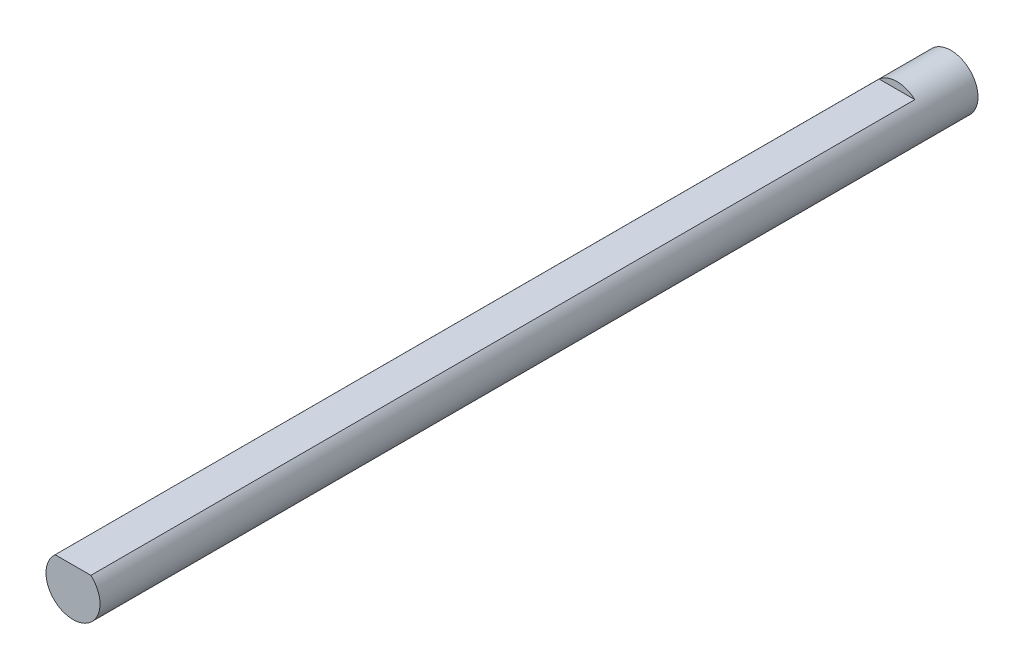
from build123d import *

# Parameters (mm, degrees)
BOSS_EXTRUDE1_DEPTH      = 65
BOSS_EXTRUDE1_DEPTH_BACK = 65
SKETCH1_R                = 4
CUT_EXTRUDE1_DEPTH       = 122


with BuildPart() as part:
    # Sketch1 → Boss-Extrude1 (new, two sides: drawn at the far end of the back side and taken through both)
    with BuildSketch(Plane.XY.offset(-BOSS_EXTRUDE1_DEPTH_BACK)):
        Circle(SKETCH1_R)
    extrude(amount=BOSS_EXTRUDE1_DEPTH + BOSS_EXTRUDE1_DEPTH_BACK)

    # Sketch2 → Cut-Extrude1 (cut)
    with BuildSketch(Plane.XY.offset(65)):
        with BuildLine():
            Line((-2.645751311, 3), (2.645751311, 3))
            ThreePointArc((2.645751311, 3), (0, 4), (-2.645751311, 3))
        make_face()
    extrude(amount=-CUT_EXTRUDE1_DEPTH, mode=Mode.SUBTRACT)


solid = part.part
